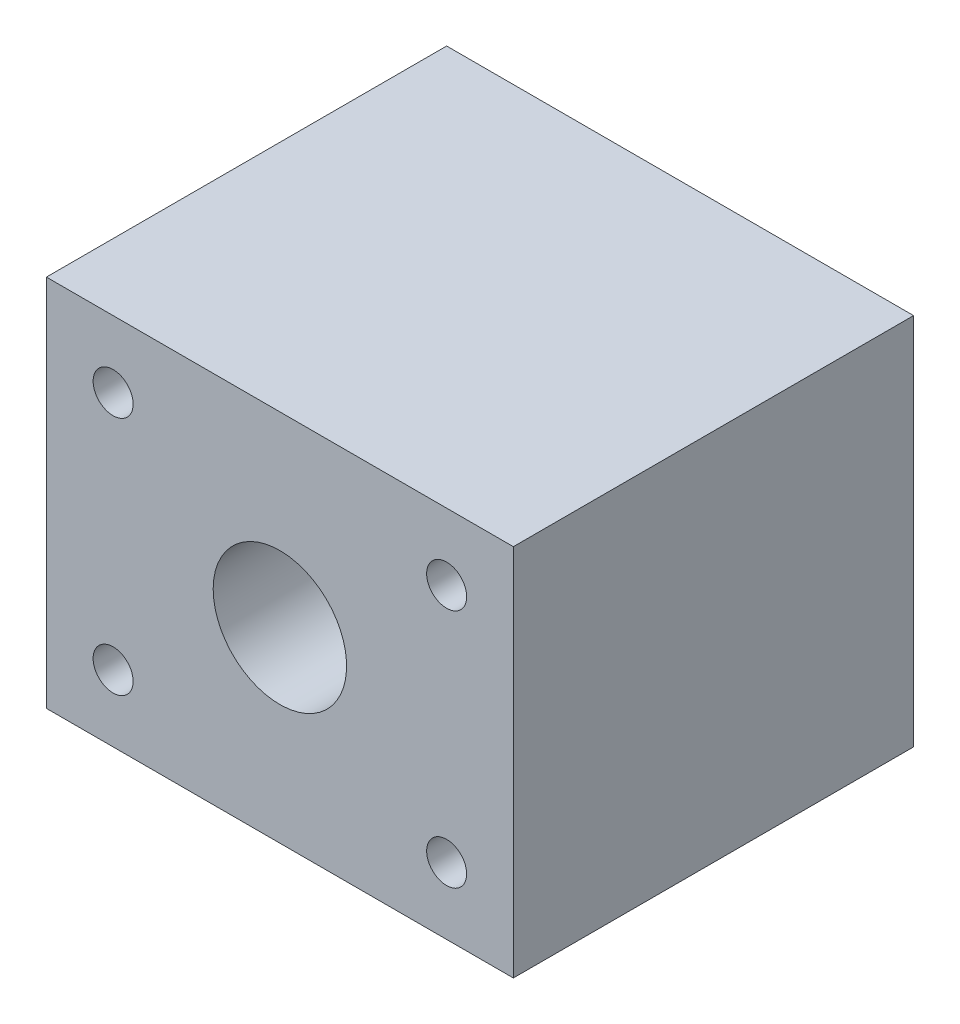
from build123d import *

# Parameters (mm, degrees)
SKETCH1_W           = 35
SKETCH1_H           = 30
BOSS_EXTRUDE1_DEPTH = 28
SKETCH2_R           = 1.5
CUT_EXTRUDE1_DEPTH  = 10
SKETCH3_R           = 11
CUT_EXTRUDE2_DEPTH  = 5
SKETCH4_R           = 5
CUT_EXTRUDE3_DEPTH  = 42.41557678


with BuildPart() as part:
    # Sketch1 → Boss-Extrude1 (new body)
    with BuildSketch(Plane(origin=(0, 0, 0), x_dir=(1, 0, 0), z_dir=(0, 1, 0))):
        Rectangle(SKETCH1_W, SKETCH1_H)
    extrude(amount=BOSS_EXTRUDE1_DEPTH)

    # Sketch2 → Cut-Extrude1 (cut)
    with BuildSketch(Plane.XY.offset(15)):
        with Locations((-12.5, 23)):
            Circle(SKETCH2_R)
        with Locations((12.5, 23)):
            Circle(SKETCH2_R)
        with Locations((12.5, 5)):
            Circle(SKETCH2_R)
        with Locations((-12.5, 5)):
            Circle(SKETCH2_R)
    extrude(amount=-CUT_EXTRUDE1_DEPTH, mode=Mode.SUBTRACT)

    # Sketch3 → Cut-Extrude2 (cut)
    with BuildSketch(Plane(origin=(0, 0, -15), x_dir=(-1, 0, 0), z_dir=(0, 0, -1))):
        with Locations((0, 14)):
            Circle(SKETCH3_R)
    extrude(amount=-CUT_EXTRUDE2_DEPTH, mode=Mode.SUBTRACT)

    # Sketch4 → Cut-Extrude3 (cut, through all)
    with BuildSketch(Plane(origin=(0, 0, -10), x_dir=(-1, 0, 0), z_dir=(0, 0, -1))):
        with Locations((0, 14)):
            Circle(SKETCH4_R)
    extrude(amount=-CUT_EXTRUDE3_DEPTH, mode=Mode.SUBTRACT)


solid = part.part
